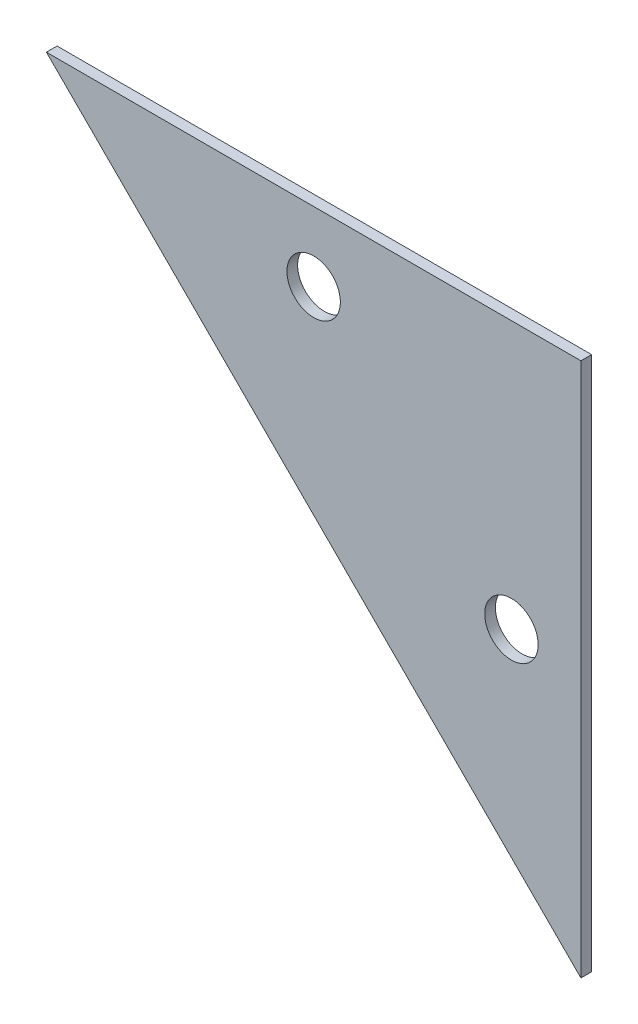
from build123d import *

# Parameters (mm, degrees)
SZKIC1_R                    = 5
DODANIE_WYCI_GNI_CIE1_DEPTH = 2


with BuildPart() as part:
    # Szkic1 → Dodanie-wyciągnięcie1 (new body)
    with BuildSketch(Plane.XY):
        Polygon((0, 0), (0, -100), (-100, 0), align=None)
        with Locations((-50, -13)):
            Circle(SZKIC1_R, mode=Mode.SUBTRACT)
        with Locations((-13, -50)):
            Circle(SZKIC1_R, mode=Mode.SUBTRACT)
    extrude(amount=DODANIE_WYCI_GNI_CIE1_DEPTH)


solid = part.part
